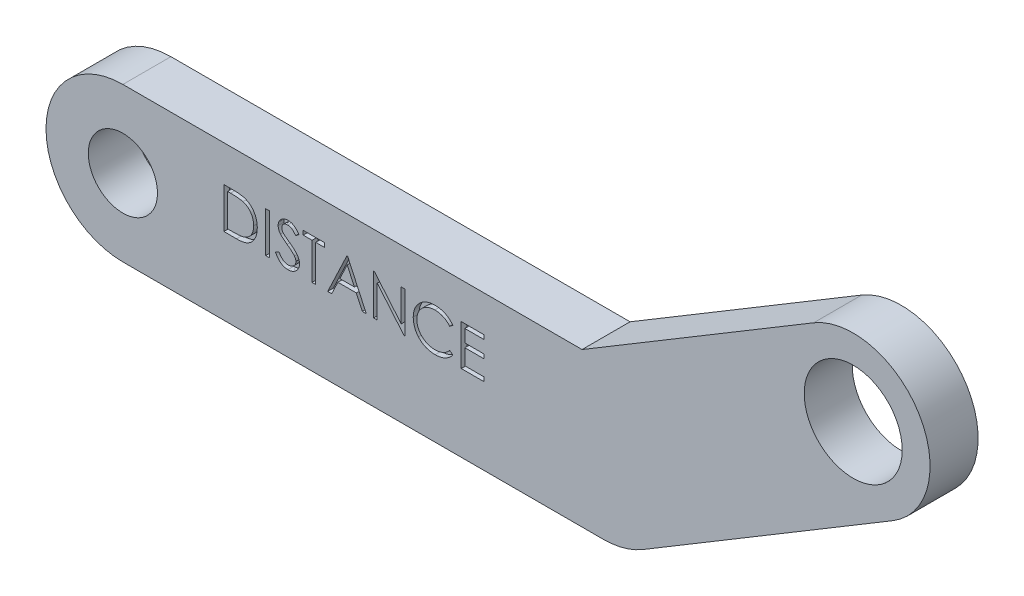
from build123d import *

# Parameters (mm, degrees)
SKETCH1_R           = 1.8
SKETCH1_R_2         = 2.55
BOSS_EXTRUDE1_DEPTH = 1.25
SKETCH2_W           = 0.189957265
SKETCH2_H           = 2.116666667
CUT_EXTRUDE1_DEPTH  = 0.3


with BuildPart() as part:
    # Sketch1 → Boss-Extrude1 (new, symmetric)
    # profile 1 of 3: a face of its own
    with BuildSketch(Plane.XY):
        with BuildLine():
            Line((-14.10793586, -3.8), (-38, -3.8))
            ThreePointArc((-38, -3.8), (-42, -7.8), (-38, -11.8))
            Line((-38, -11.8), (-13, -11.8))
            ThreePointArc((-13, -11.8), (-16.854859713, -8.867734328), (-15.057983022, -4.370028297))
            Line((-15.057983022, -4.370028297), (-14.10793586, -3.8))
        make_face()
        with Locations((-38, -7.8)):
            Circle(SKETCH1_R, mode=Mode.SUBTRACT)
    # profile 2 of 3: a face of its own
    with BuildSketch(Plane.XY):
        with BuildLine():
            Line((-13, -3.8), (-14.10793586, -3.8))
            Line((-14.10793586, -3.8), (-15.057983022, -4.370028297))
            ThreePointArc((-15.057983022, -4.370028297), (-16.854859713, -8.867734328), (-13, -11.8))
            ThreePointArc((-13, -11.8), (-11.932265672, -11.654859713), (-10.942016978, -11.229971703))
            ThreePointArc((-10.942016978, -11.229971703), (-9.145140287, -6.732265672), (-13, -3.8))
        make_face()
    # profile 3 of 3: a face of its own
    with BuildSketch(Plane.XY):
        with BuildLine():
            Line((-2.057983022, 3.429971703), (-14.10793586, -3.8))
            Line((-14.10793586, -3.8), (-13, -3.8))
            ThreePointArc((-13, -3.8), (-9.145140287, -6.732265672), (-10.942016978, -11.229971703))
            Line((-10.942016978, -11.229971703), (2.057983022, -3.429971703))
            ThreePointArc((2.057983022, -3.429971703), (3.429971703, 2.057983022), (-2.057983022, 3.429971703))
        make_face()
        Circle(SKETCH1_R_2, mode=Mode.SUBTRACT)
    extrude(amount=BOSS_EXTRUDE1_DEPTH, both=True)

    # Sketch2 → Cut-Extrude1 (cut)
    # profile 1 of 8: a face of its own
    with BuildSketch(Plane.XY.offset(1.25)):
        with BuildLine():
            Line((-32.743177332, -7.8), (-32.743177332, -5.683333333))
            Line((-32.743177332, -5.683333333), (-32.315773485, -5.683333333))
            add(Edge.make_bspline(
                [(-32.315773485, -5.683333333), (-32.278599383, -5.683600983), (-32.206779211, -5.68411808), (-32.10299454, -5.687396731), (-32.006968169, -5.693196679), (-31.919015917, -5.701644917), (-31.838896326, -5.712018418), (-31.76683374, -5.725021043), (-31.702455539, -5.740374842), (-31.662862115, -5.753465185), (-31.64413887, -5.759655449)],
                knots=[0, 0, 0, 0, 1.314313732, 2.53924729, 3.670748893, 4.714932338, 5.66265055, 6.526160246, 7.303039223, 8, 8, 8, 8], degree=3))
            add(Edge.make_bspline(
                [(-31.64413887, -5.759655449), (-31.619649194, -5.768987352), (-31.571225188, -5.787439541), (-31.502278023, -5.822247399), (-31.437371732, -5.861685799), (-31.376158249, -5.905806725), (-31.320035845, -5.955859451), (-31.266812021, -6.009717783), (-31.218664069, -6.069340256), (-31.174571909, -6.133490367), (-31.134817487, -6.201412418), (-31.100261901, -6.272976984), (-31.071563533, -6.347820629), (-31.047740011, -6.425735218), (-31.028964296, -6.506892075), (-31.016154271, -6.591385699), (-31.007705148, -6.678882161), (-31.006856031, -6.738254337), (-31.006425195, -6.768379407)],
                knots=[0, 0, 0, 0, 0.984719456, 1.947108742, 2.898477687, 3.838006223, 4.779231079, 5.722358779, 6.681677486, 7.655904652, 8.64651281, 9.637519902, 10.640069247, 11.656948941, 12.698408672, 13.768548281, 14.867775369, 16, 16, 16, 16], degree=3))
            add(Edge.make_bspline(
                [(-31.006425195, -6.768379407), (-31.00680557, -6.794542156), (-31.00755514, -6.846098586), (-31.014285726, -6.922081413), (-31.024068549, -6.995810097), (-31.039214325, -7.066933544), (-31.057600607, -7.136074894), (-31.081164642, -7.202497252), (-31.108158489, -7.266809936), (-31.139636273, -7.328143362), (-31.174193206, -7.386250926), (-31.21127826, -7.441027555), (-31.250851881, -7.491691617), (-31.29329143, -7.53839654), (-31.338048478, -7.581071913), (-31.385416049, -7.620074227), (-31.43551637, -7.654640334), (-31.488125045, -7.686128538), (-31.5447768, -7.713597039), (-31.606544681, -7.736838045), (-31.673692107, -7.756097664), (-31.746054262, -7.77216673), (-31.823756175, -7.78491348), (-31.906874026, -7.793456584), (-31.99528011, -7.799233833), (-32.055985666, -7.799739652), (-32.087231151, -7.8)],
                knots=[0, 0, 0, 0, 1.105936401, 2.179363191, 3.223086493, 4.248585256, 5.251745608, 6.245858792, 7.225916811, 8.198733463, 9.158002045, 10.082870192, 10.993790845, 11.873723703, 12.748670949, 13.606408763, 14.465103618, 15.319838547, 16.196477973, 17.123216899, 18.106603292, 19.147568657, 20.255746949, 21.433717677, 22.679120308, 24, 24, 24, 24], degree=3))
            Line((-32.087231151, -7.8), (-32.743177332, -7.8))
        make_face()
        with BuildLine():
            Line((-32.553220067, -7.582905983), (-32.310261333, -7.582905983))
            add(Edge.make_bspline(
                [(-32.310261333, -7.582905983), (-32.275349413, -7.582755944), (-32.208201007, -7.582467363), (-32.111645932, -7.579935102), (-32.02342363, -7.575797359), (-31.943521575, -7.570006717), (-31.871984879, -7.562345221), (-31.80866404, -7.553803018), (-31.753766622, -7.54316075), (-31.720547391, -7.533514218), (-31.705196562, -7.52905649)],
                knots=[0, 0, 0, 0, 1.375205317, 2.645023457, 3.804390687, 4.853969522, 5.800190428, 6.637939096, 7.370582563, 8, 8, 8, 8], degree=3))
            add(Edge.make_bspline(
                [(-31.705196562, -7.52905649), (-31.68587541, -7.522251977), (-31.647694591, -7.508805475), (-31.592733173, -7.484277746), (-31.541475365, -7.455223733), (-31.493027874, -7.422928072), (-31.448077944, -7.38625168), (-31.406092883, -7.345992082), (-31.367157222, -7.301944385), (-31.331673236, -7.254163258), (-31.299918214, -7.202946096), (-31.272418947, -7.148796421), (-31.248318258, -7.09230754), (-31.229402157, -7.032612001), (-31.214576066, -6.970243476), (-31.204074564, -6.905197575), (-31.197534231, -6.837486448), (-31.196771355, -6.791432544), (-31.19638246, -6.767955395)],
                knots=[0, 0, 0, 0, 0.998632004, 1.973411704, 2.929992603, 3.868527914, 4.809262121, 5.754881198, 6.702106254, 7.672490631, 8.653608572, 9.636854334, 10.631411391, 11.644891563, 12.686317036, 13.754757253, 14.855430412, 16, 16, 16, 16], degree=3))
            add(Edge.make_bspline(
                [(-31.19638246, -6.767955395), (-31.196692876, -6.743200386), (-31.197302693, -6.69456895), (-31.204967633, -6.623212673), (-31.216168764, -6.554583898), (-31.232366517, -6.488678037), (-31.253007572, -6.42536651), (-31.278767189, -6.364999473), (-31.308198906, -6.306939386), (-31.343216639, -6.252526317), (-31.381567974, -6.201065246), (-31.424129834, -6.153921083), (-31.470226019, -6.110986435), (-31.519353761, -6.07159266), (-31.572897626, -6.037324627), (-31.629596287, -6.006671254), (-31.690281526, -5.980656881), (-31.732501585, -5.966820617), (-31.753957914, -5.959788996)],
                knots=[0, 0, 0, 0, 1.122418816, 2.205001699, 3.251619955, 4.274784885, 5.280384055, 6.268708349, 7.249350384, 8.229342522, 9.199999885, 10.157847722, 11.105861043, 12.055065948, 13.010012805, 13.98527497, 14.976112212, 16, 16, 16, 16], degree=3))
            add(Edge.make_bspline(
                [(-31.753957914, -5.959788996), (-31.771708369, -5.954880489), (-31.809450707, -5.944443658), (-31.871039335, -5.93305879), (-31.940354211, -5.923017021), (-32.017703078, -5.914515255), (-32.102997765, -5.908414827), (-32.196303872, -5.903835984), (-32.297661728, -5.900747688), (-32.367924498, -5.900536803), (-32.404391942, -5.90042735)],
                knots=[0, 0, 0, 0, 0.674548936, 1.434276114, 2.292660221, 3.240891867, 4.284742987, 5.42552168, 6.663806718, 8, 8, 8, 8], degree=3))
            Line((-32.404391942, -5.90042735), (-32.553220067, -5.90042735))
            Line((-32.553220067, -5.90042735), (-32.553220067, -7.582905983))
        make_face(mode=Mode.SUBTRACT)
    # profile 2 of 8: a face of its own
    with BuildSketch(Plane.XY.offset(1.25)):
        with Locations((-30.477258529, -6.741666667)):
            Rectangle(SKETCH2_W, SKETCH2_H)
    # profile 3 of 8: a face of its own
    with BuildSketch(Plane.XY.offset(1.25)):
        with BuildLine():
            Line((-30.05663887, -7.391676683), (-29.877705911, -7.284401709))
            add(Edge.make_bspline(
                [(-29.877705911, -7.284401709), (-29.861063929, -7.312259695), (-29.829178535, -7.365634519), (-29.775988903, -7.437757239), (-29.72087519, -7.49905721), (-29.66342926, -7.549177825), (-29.604001758, -7.588637866), (-29.542204735, -7.616579216), (-29.47824644, -7.63400602), (-29.434719415, -7.636122739), (-29.41298903, -7.637179487)],
                knots=[0, 0, 0, 0, 1.272034388, 2.437168799, 3.508375237, 4.49857839, 5.41946034, 6.295179144, 7.148887113, 8, 8, 8, 8], degree=3))
            add(Edge.make_bspline(
                [(-29.41298903, -7.637179487), (-29.394430786, -7.636662614), (-29.357639023, -7.635637911), (-29.303475191, -7.625791902), (-29.25087191, -7.61066552), (-29.200913353, -7.589002385), (-29.154288862, -7.56279292), (-29.113402909, -7.531135946), (-29.078056926, -7.495693145), (-29.049143795, -7.456152206), (-29.026961107, -7.413627073), (-29.009911618, -7.369977808), (-29.000450073, -7.324518721), (-28.999024798, -7.293911441), (-28.998305537, -7.278465545)],
                knots=[0, 0, 0, 0, 1.095163259, 2.171163733, 3.241058638, 4.321873601, 5.38011039, 6.391990106, 7.366004449, 8.327778327, 9.272591725, 10.192022065, 11.087607919, 12, 12, 12, 12], degree=3))
            add(Edge.make_bspline(
                [(-28.998305537, -7.278465545), (-28.999197144, -7.260842269), (-29.00100965, -7.225016725), (-29.016329164, -7.172160744), (-29.040428471, -7.119853333), (-29.062661117, -7.087497805), (-29.07420364, -7.070699786)],
                knots=[0, 0, 0, 0, 0.938893495, 1.908633276, 2.914225137, 4, 4, 4, 4], degree=3))
            add(Edge.make_bspline(
                [(-29.07420364, -7.070699786), (-29.083680631, -7.058576231), (-29.103576387, -7.033124343), (-29.137780216, -6.995238891), (-29.177915914, -6.956160133), (-29.222609968, -6.914395847), (-29.273490455, -6.871888465), (-29.328963762, -6.826610982), (-29.390446191, -6.780285267), (-29.43356541, -6.749217096), (-29.455814217, -6.733186432)],
                knots=[0, 0, 0, 0, 0.722233717, 1.516239348, 2.393582979, 3.351407094, 4.387010283, 5.505090956, 6.712668013, 8, 8, 8, 8], degree=3))
            add(Edge.make_bspline(
                [(-29.455814217, -6.733186432), (-29.478083967, -6.717324381), (-29.520662034, -6.686997348), (-29.580206033, -6.641988376), (-29.633451971, -6.600838036), (-29.680163185, -6.563158943), (-29.720319132, -6.528945987), (-29.754236243, -6.49852771), (-29.781050513, -6.471081461), (-29.795961269, -6.453276459), (-29.802655831, -6.445282452)],
                knots=[0, 0, 0, 0, 1.452282411, 2.77665338, 3.964542531, 5.026858415, 5.96415736, 6.766646006, 7.446254459, 8, 8, 8, 8], degree=3))
            add(Edge.make_bspline(
                [(-29.802655831, -6.445282452), (-29.812013036, -6.43282373), (-29.830415238, -6.40832198), (-29.854706108, -6.370025519), (-29.875352173, -6.330822877), (-29.891537012, -6.290608711), (-29.905166058, -6.249947588), (-29.914332997, -6.208308977), (-29.920073033, -6.165879718), (-29.920660853, -6.137326791), (-29.920955109, -6.12303352)],
                knots=[0, 0, 0, 0, 1.068054152, 2.10047183, 3.106115577, 4.101338837, 5.06977816, 6.043150881, 7.020423561, 8, 8, 8, 8], degree=3))
            add(Edge.make_bspline(
                [(-29.920955109, -6.12303352), (-29.920165769, -6.100639323), (-29.918603959, -6.05632959), (-29.905395646, -5.991601421), (-29.884547753, -5.929802968), (-29.855340845, -5.871546052), (-29.81768997, -5.818347578), (-29.774119309, -5.769595612), (-29.722223791, -5.728611755), (-29.665283871, -5.692802558), (-29.602959303, -5.664774308), (-29.537650519, -5.643631239), (-29.469253718, -5.631651355), (-29.422927061, -5.629932159), (-29.399420654, -5.629059829)],
                knots=[0, 0, 0, 0, 1.005424448, 1.989358655, 2.955360095, 3.929531133, 4.905563448, 5.876582895, 6.856512386, 7.866279853, 8.892233794, 9.918561126, 10.94386622, 12, 12, 12, 12], degree=3))
            add(Edge.make_bspline(
                [(-29.399420654, -5.629059829), (-29.374477794, -5.629920134), (-29.324874405, -5.631631006), (-29.251910355, -5.646506656), (-29.181660779, -5.671120872), (-29.125149852, -5.699054013), (-29.080921944, -5.726952535), (-29.04719272, -5.752364524), (-29.013013119, -5.781619947), (-28.978107438, -5.814796729), (-28.943067135, -5.852199288), (-28.907371999, -5.893571467), (-28.87093856, -5.938660432), (-28.847500493, -5.970848582), (-28.835485024, -5.98734976)],
                knots=[0, 0, 0, 0, 1.286793592, 2.559021753, 3.825965368, 5.121522368, 5.803751409, 6.523245864, 7.299691795, 8.125521123, 9.008227632, 9.944561021, 10.946284179, 12, 12, 12, 12], degree=3))
            Line((-28.835485024, -5.98734976), (-29.007209784, -6.117521368))
            add(Edge.make_bspline(
                [(-29.007209784, -6.117521368), (-29.01757899, -6.104162969), (-29.037547658, -6.078437817), (-29.067864062, -6.042411355), (-29.096438244, -6.009502341), (-29.124590153, -5.980918192), (-29.150832968, -5.955093568), (-29.176303751, -5.93298362), (-29.200635954, -5.914371712), (-29.231307609, -5.894509179), (-29.269841658, -5.874820246), (-29.318213258, -5.858159613), (-29.368763053, -5.848147742), (-29.403191926, -5.846823986), (-29.420621242, -5.846153846)],
                knots=[0, 0, 0, 0, 1.181633172, 2.275549214, 3.290209073, 4.226197932, 5.078386478, 5.862611352, 6.581680152, 7.217281963, 8.414376989, 9.595101626, 10.782541182, 12, 12, 12, 12], degree=3))
            add(Edge.make_bspline(
                [(-29.420621242, -5.846153846), (-29.442487329, -5.846886636), (-29.484654019, -5.848299753), (-29.544519543, -5.863733267), (-29.598400154, -5.888033726), (-29.644696229, -5.922090879), (-29.683241925, -5.962441194), (-29.71112475, -6.008874121), (-29.727906993, -6.060147288), (-29.729954885, -6.095913909), (-29.730997844, -6.114129274)],
                knots=[0, 0, 0, 0, 1.14458467, 2.207223713, 3.21896685, 4.227309161, 5.202851033, 6.127160689, 7.046193047, 8, 8, 8, 8], degree=3))
            add(Edge.make_bspline(
                [(-29.730997844, -6.114129274), (-29.730760096, -6.125469453), (-29.730284212, -6.148168357), (-29.723647072, -6.181703264), (-29.715120335, -6.215153455), (-29.701608362, -6.248368541), (-29.682954298, -6.281929415), (-29.658458311, -6.31641399), (-29.627607403, -6.352126214), (-29.603975114, -6.37535353), (-29.591497978, -6.387616854)],
                knots=[0, 0, 0, 0, 0.858281714, 1.717966888, 2.583508476, 3.4729293, 4.427298488, 5.488583878, 6.674047936, 8, 8, 8, 8], degree=3))
            add(Edge.make_bspline(
                [(-29.591497978, -6.387616854), (-29.586864672, -6.391751626), (-29.575856997, -6.4015749), (-29.555732985, -6.417656898), (-29.529158054, -6.437494765), (-29.496826152, -6.462040428), (-29.458141128, -6.490513503), (-29.41309873, -6.522549925), (-29.362201041, -6.559189703), (-29.326083501, -6.58480593), (-29.306986092, -6.598350694)],
                knots=[0, 0, 0, 0, 0.420754252, 0.999615792, 1.744751191, 2.668019286, 3.750313428, 4.999500688, 6.413464383, 8, 8, 8, 8], degree=3))
            add(Edge.make_bspline(
                [(-29.306986092, -6.598350694), (-29.284013659, -6.615067136), (-29.239530726, -6.647436207), (-29.176237808, -6.696068547), (-29.118849648, -6.743631721), (-29.067164759, -6.789821989), (-29.020672533, -6.834288978), (-28.979888769, -6.877567663), (-28.944397905, -6.919347986), (-28.90618952, -6.972913306), (-28.86714741, -7.038699961), (-28.833618499, -7.119301563), (-28.812477022, -7.20021648), (-28.809712344, -7.254600805), (-28.808348272, -7.281433627)],
                knots=[0, 0, 0, 0, 1.163667725, 2.253281268, 3.268753668, 4.215851969, 5.092017293, 5.902905408, 6.650798638, 7.335211899, 8.59617414, 9.77448103, 10.901945474, 12, 12, 12, 12], degree=3))
            add(Edge.make_bspline(
                [(-28.808348272, -7.281433627), (-28.808745684, -7.300410067), (-28.809532791, -7.337994437), (-28.818580581, -7.393182031), (-28.83183676, -7.446782605), (-28.85181642, -7.498133611), (-28.87620233, -7.548174491), (-28.907145728, -7.595592602), (-28.943012756, -7.641437424), (-28.984156985, -7.684486488), (-29.029179031, -7.724005378), (-29.076763932, -7.75915962), (-29.126989573, -7.788471416), (-29.179583489, -7.812390258), (-29.234557759, -7.831097671), (-29.291893895, -7.844652121), (-29.351686409, -7.852971051), (-29.3923267, -7.853834506), (-29.41298903, -7.854273504)],
                knots=[0, 0, 0, 0, 0.983748083, 1.948392443, 2.894712957, 3.844097841, 4.80183111, 5.778335162, 6.776009319, 7.81870978, 8.863265674, 9.881300176, 10.883814829, 11.87499822, 12.874611388, 13.892143829, 14.928324115, 16, 16, 16, 16], degree=3))
            add(Edge.make_bspline(
                [(-29.41298903, -7.854273504), (-29.428976119, -7.853964361), (-29.460748955, -7.853349968), (-29.507744689, -7.847918432), (-29.553791012, -7.84023366), (-29.598310125, -7.828033151), (-29.641875608, -7.813230407), (-29.684297983, -7.795003892), (-29.72559781, -7.773161585), (-29.766006539, -7.748187927), (-29.805421397, -7.719124434), (-29.843472694, -7.685273795), (-29.881408916, -7.647569609), (-29.918110342, -7.604987983), (-29.954319338, -7.558216856), (-29.989321996, -7.506818636), (-30.023842844, -7.451073284), (-30.045502674, -7.411845351), (-30.05663887, -7.391676683)],
                knots=[0, 0, 0, 0, 0.915332311, 1.819136955, 2.706846663, 3.586547465, 4.459518054, 5.340707479, 6.227863349, 7.133153174, 8.059268498, 9.028702269, 10.047606654, 11.120612155, 12.245963614, 13.433783089, 14.680604001, 16, 16, 16, 16], degree=3))
        make_face()
    # profile 4 of 8: a face of its own
    with BuildSketch(Plane.XY.offset(1.25)):
        Polygon((-28.618391007, -5.90042735), (-28.618391007, -5.683333333), (-27.505784169, -5.683333333), (-27.505784169, -5.90042735), (-27.967108956, -5.90042735), (-27.967108956, -7.8), (-28.15706622, -7.8), (-28.15706622, -5.90042735), align=None)
    # profile 5 of 8: a face of its own
    with BuildSketch(Plane.XY.offset(1.25)):
        Polygon((-26.311767075, -5.683333333), (-25.334843998, -7.8), (-25.541337722, -7.8), (-25.854258395, -7.121581197), (-26.81379699, -7.121581197), (-27.135197898, -7.8), (-27.342963656, -7.8), (-26.338903827, -5.683333333), align=None)
        Polygon((-26.32745551, -6.09632078), (-26.710338122, -6.904487179), (-25.954325168, -6.904487179), align=None, mode=Mode.SUBTRACT)
    # profile 6 of 8: a face of its own
    with BuildSketch(Plane.XY.offset(1.25)):
        Polygon((-24.954929468, -7.8), (-24.954929468, -5.683333333), (-24.915072364, -5.683333333), (-23.516681605, -7.349275507), (-23.516681605, -5.683333333), (-23.32672434, -5.683333333), (-23.32672434, -7.8), (-23.369973539, -7.8), (-24.764972203, -6.137873932), (-24.764972203, -7.8), align=None)
    # profile 7 of 8: a face of its own
    with BuildSketch(Plane.XY.offset(1.25)):
        with BuildLine():
            Line((-20.830143144, -6.071728098), (-20.99635575, -6.198931624))
            add(Edge.make_bspline(
                [(-20.99635575, -6.198931624), (-21.008212645, -6.184800776), (-21.031766577, -6.156729593), (-21.069660476, -6.117311488), (-21.109152422, -6.080381544), (-21.150227319, -6.045763836), (-21.1936245, -6.014668935), (-21.238292698, -5.98547641), (-21.284979135, -5.959309731), (-21.349538517, -5.927582115), (-21.433992216, -5.894473726), (-21.540306237, -5.866713201), (-21.651286759, -5.849041347), (-21.727001498, -5.847127371), (-21.765513069, -5.846153846)],
                knots=[0, 0, 0, 0, 0.757959112, 1.505699292, 2.245454638, 2.979532153, 3.711538275, 4.438200793, 5.171680507, 5.909471876, 7.393775596, 8.890124382, 10.418191784, 12, 12, 12, 12], degree=3))
            add(Edge.make_bspline(
                [(-21.765513069, -5.846153846), (-21.786730112, -5.846398147), (-21.828967283, -5.846884482), (-21.891649932, -5.853300477), (-21.95316211, -5.862318209), (-22.013463806, -5.875698761), (-22.072478262, -5.892615536), (-22.130591286, -5.912829953), (-22.186961506, -5.937839785), (-22.242368727, -5.965482399), (-22.295454249, -5.996704711), (-22.345682778, -6.030760881), (-22.392871121, -6.06726981), (-22.437056605, -6.106368337), (-22.478284403, -6.147880379), (-22.516255776, -6.192248338), (-22.550839334, -6.239330367), (-22.582720582, -6.288505618), (-22.611273045, -6.339630854), (-22.63517921, -6.392895302), (-22.656348975, -6.447386831), (-22.673100421, -6.503721104), (-22.686359534, -6.561501729), (-22.695508168, -6.620883777), (-22.701851196, -6.681743193), (-22.702335113, -6.722993587), (-22.702579041, -6.743786725)],
                knots=[0, 0, 0, 0, 1.054917814, 2.100044995, 3.131103042, 4.146048494, 5.169673617, 6.183595914, 7.203665975, 8.234915748, 9.262203917, 10.264457458, 11.251630812, 12.227803204, 13.197192746, 14.159520551, 15.12972552, 16.100847026, 17.073214652, 18.039054194, 19.002613845, 19.979014051, 20.95965708, 21.949030935, 22.966165397, 24, 24, 24, 24], degree=3))
            add(Edge.make_bspline(
                [(-22.702579041, -6.743786725), (-22.701815941, -6.775071857), (-22.700317695, -6.836496063), (-22.686983703, -6.926466861), (-22.6667211, -7.012657935), (-22.636352632, -7.094530506), (-22.598906349, -7.173094132), (-22.551589408, -7.247019534), (-22.496787978, -7.317423838), (-22.433726781, -7.382643144), (-22.364538502, -7.442220492), (-22.290305241, -7.494683939), (-22.211211886, -7.538417225), (-22.128131734, -7.574809345), (-22.040425465, -7.602783652), (-21.948250799, -7.622477193), (-21.851808211, -7.635323655), (-21.785907669, -7.636553552), (-21.752368704, -7.637179487)],
                knots=[0, 0, 0, 0, 1.029171465, 2.020641659, 2.987623507, 3.938342917, 4.889210282, 5.84687017, 6.821220943, 7.821438502, 8.827599549, 9.822697543, 10.807740252, 11.797342354, 12.80366471, 13.83203677, 14.896651826, 16, 16, 16, 16], degree=3))
            add(Edge.make_bspline(
                [(-21.752368704, -7.637179487), (-21.715416126, -7.636158178), (-21.642684611, -7.634147996), (-21.536023948, -7.617118355), (-21.433918509, -7.589506185), (-21.336362802, -7.550863156), (-21.243631849, -7.500628434), (-21.155580535, -7.439730194), (-21.072134538, -7.367589155), (-21.021956667, -7.312505549), (-20.99635575, -7.284401709)],
                knots=[0, 0, 0, 0, 1.028121516, 2.023589091, 2.998037872, 3.967518031, 4.937445131, 5.927275754, 6.942489185, 8, 8, 8, 8], degree=3))
            Line((-20.99635575, -7.284401709), (-20.830143144, -7.4103332))
            add(Edge.make_bspline(
                [(-20.830143144, -7.4103332), (-20.843519334, -7.427592168), (-20.870207643, -7.462027436), (-20.91342273, -7.510572708), (-20.958947571, -7.556234672), (-21.00712031, -7.598645186), (-21.057386784, -7.638652887), (-21.110649564, -7.675121137), (-21.166208455, -7.708558958), (-21.223875211, -7.739176193), (-21.283588563, -7.766340433), (-21.345276959, -7.789595807), (-21.408674497, -7.809628478), (-21.473784076, -7.826109411), (-21.540740748, -7.838973352), (-21.609302892, -7.84757287), (-21.679618483, -7.853464409), (-21.727056867, -7.854001386), (-21.751096669, -7.854273504)],
                knots=[0, 0, 0, 0, 0.986787822, 1.968848986, 2.935600012, 3.899624008, 4.868462664, 5.837806735, 6.815139263, 7.798259679, 8.787526145, 9.778297419, 10.776456485, 11.791383307, 12.812564526, 13.85620153, 14.913611965, 16, 16, 16, 16], degree=3))
            add(Edge.make_bspline(
                [(-21.751096669, -7.854273504), (-21.773862125, -7.854115061), (-21.818877995, -7.85380176), (-21.885340573, -7.848726496), (-21.950043796, -7.841802132), (-22.012802736, -7.831375957), (-22.073959873, -7.819072475), (-22.132960798, -7.802579858), (-22.190386092, -7.784104886), (-22.246005041, -7.762390918), (-22.299864955, -7.737888274), (-22.351792117, -7.710195284), (-22.401762645, -7.679544823), (-22.450267828, -7.646612507), (-22.496591129, -7.61034052), (-22.541133975, -7.571232603), (-22.584146139, -7.529420567), (-22.610757287, -7.499270251), (-22.624136867, -7.484111245)],
                knots=[0, 0, 0, 0, 1.114604814, 2.203992996, 3.262667896, 4.300477797, 5.318619304, 6.316056647, 7.298880507, 8.271930387, 9.238335007, 10.195173496, 11.151986948, 12.108099108, 13.064862484, 14.031167946, 15.010108607, 16, 16, 16, 16], degree=3))
            add(Edge.make_bspline(
                [(-22.624136867, -7.484111245), (-22.645566994, -7.457779192), (-22.688168525, -7.405432991), (-22.742673105, -7.320593374), (-22.789329008, -7.232014981), (-22.827051588, -7.139232453), (-22.856541432, -7.042453985), (-22.876971012, -6.941630793), (-22.890246506, -6.836857038), (-22.891764633, -6.765593837), (-22.892536306, -6.729370326)],
                knots=[0, 0, 0, 0, 0.994628077, 1.977248131, 2.950237994, 3.925870899, 4.908910175, 5.911660606, 6.938484602, 8, 8, 8, 8], degree=3))
            add(Edge.make_bspline(
                [(-22.892536306, -6.729370326), (-22.891595784, -6.691297266), (-22.889745366, -6.616390897), (-22.874024099, -6.506460935), (-22.848733685, -6.401140803), (-22.812812709, -6.30062711), (-22.767270901, -6.204391179), (-22.711011949, -6.113168164), (-22.644689439, -6.026374671), (-22.568823529, -5.945327655), (-22.485628046, -5.871220523), (-22.396535239, -5.806023438), (-22.30171949, -5.751765702), (-22.202225361, -5.70641088), (-22.09730783, -5.671549704), (-21.987190745, -5.647145634), (-21.87208102, -5.631955759), (-21.793545172, -5.630035514), (-21.75364074, -5.629059829)],
                knots=[0, 0, 0, 0, 1.032925535, 2.032216505, 3.007276963, 3.968222605, 4.92396291, 5.891752235, 6.871517503, 7.883894988, 8.900124299, 9.891468569, 10.874487609, 11.85992873, 12.854644235, 13.869047385, 14.917252991, 16, 16, 16, 16], degree=3))
            add(Edge.make_bspline(
                [(-21.75364074, -5.629059829), (-21.729320559, -5.629351408), (-21.681181211, -5.629928559), (-21.609968892, -5.635556559), (-21.54063758, -5.644938597), (-21.47313951, -5.657708792), (-21.407146309, -5.673557981), (-21.343162354, -5.694204733), (-21.280812196, -5.71781254), (-21.220489065, -5.745001708), (-21.16248239, -5.77552207), (-21.106810235, -5.809035328), (-21.053914821, -5.845499935), (-21.003423946, -5.88460576), (-20.956182237, -5.927180127), (-20.910848391, -5.972052006), (-20.868961929, -6.02051389), (-20.843106425, -6.054625445), (-20.830143144, -6.071728098)],
                knots=[0, 0, 0, 0, 1.096760587, 2.17092713, 3.219439832, 4.250915756, 5.268269357, 6.278326846, 7.281116186, 8.274029601, 9.260640565, 10.235837813, 11.203064059, 12.156899882, 13.114053108, 14.069676657, 15.032185724, 16, 16, 16, 16], degree=3))
        make_face()
    # profile 8 of 8: a face of its own
    with BuildSketch(Plane.XY.offset(1.25)):
        Polygon((-20.395955109, -5.683333333), (-19.201938015, -5.683333333), (-19.201938015, -5.90042735), (-20.205997844, -5.90042735), (-20.205997844, -6.551709402), (-19.201938015, -6.551709402), (-19.201938015, -6.768803419), (-20.205997844, -6.768803419), (-20.205997844, -7.582905983), (-19.201938015, -7.582905983), (-19.201938015, -7.8), (-20.395955109, -7.8), align=None)
    cut_extrude1 = extrude(amount=-CUT_EXTRUDE1_DEPTH, mode=Mode.SUBTRACT)

    # Mirror1: Cut-Extrude1 across plane
    add(cut_extrude1.mirror(Plane.XY), mode=Mode.SUBTRACT)


solid = part.part
